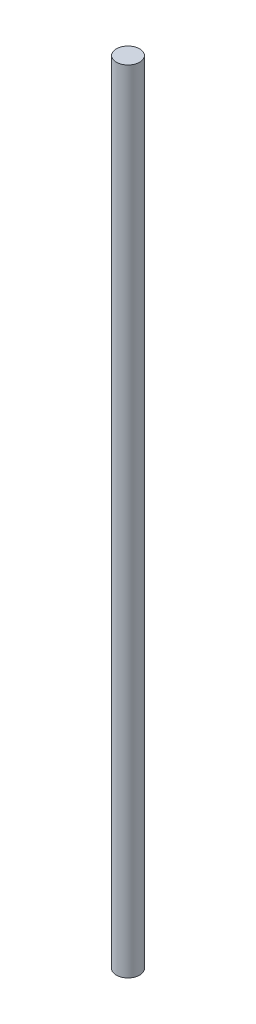
from build123d import *

# Parameters (mm, degrees)
SKETCH1_R           = 2.5
BOSS_EXTRUDE1_DEPTH = 170


with BuildPart() as part:
    # Sketch1 → Boss-Extrude1 (new body)
    with BuildSketch(Plane(origin=(0, 0, 0), x_dir=(1, 0, 0), z_dir=(0, 1, 0))):
        with Locations(Location((0, 0, 0), (0, 0, 270))):
            Circle(SKETCH1_R)
    extrude(amount=BOSS_EXTRUDE1_DEPTH)


solid = part.part
